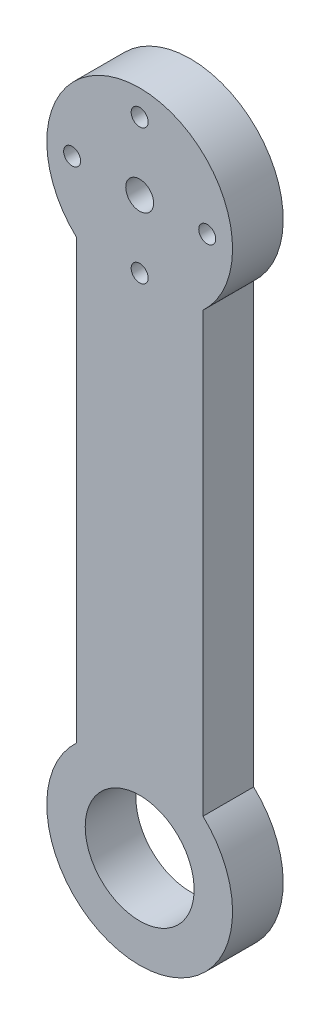
from build123d import *

# Parameters (mm, degrees)
ESQUISSE1_W             = 15
ESQUISSE1_H             = 83
BOSS_EXTRU_1_DEPTH      = 6
ESQUISSE2_R             = 11
BOSS_EXTRU_2_DEPTH      = 6
ESQUISSE4_R             = 1.65
ESQUISSE4_R_2           = 1.005
ESQUISSE4_R_3           = 6.45
ENL_V_MAT_EXTRU_2_DEPTH = 10
ESQUISSE5_R             = 3
ESQUISSE5_R_2           = 2
ENL_V_MAT_EXTRU_3_DEPTH = 3


with BuildPart() as part:
    # Esquisse1 → Boss.-Extru.1 (new body)
    with BuildSketch(Plane.XY):
        with Locations((7.5, 41.5)):
            Rectangle(ESQUISSE1_W, ESQUISSE1_H)
    extrude(amount=BOSS_EXTRU_1_DEPTH)

    # Esquisse2 → Boss.-Extru.2 (add)
    with BuildSketch(Plane.XY.offset(6)):
        with Locations((7.5, 7.5)):
            Circle(ESQUISSE2_R)
        with Locations((7.5, 75.5)):
            Circle(ESQUISSE2_R)
    extrude(amount=-BOSS_EXTRU_2_DEPTH)

    # Esquisse4 → Enlèv. mat.-Extru.2 (cut)
    with BuildSketch(Plane(origin=(0, 0, 0), x_dir=(-1, 0, 0), z_dir=(0, 0, -1))):
        with Locations((-7.5, 75.5)):
            Circle(ESQUISSE4_R)
        with Locations((-7.5, 67.5)):
            Circle(ESQUISSE4_R_2)
        with Locations((-15.5, 75.5)):
            Circle(ESQUISSE4_R_2)
        with Locations((-7.5, 83.5)):
            Circle(ESQUISSE4_R_2)
        with Locations((0.5, 75.5)):
            Circle(ESQUISSE4_R_2)
        with Locations((-7.5, 7.5)):
            Circle(ESQUISSE4_R_3)
    extrude(amount=-ENL_V_MAT_EXTRU_2_DEPTH, mode=Mode.SUBTRACT)

    # Esquisse5 → Enlèv. mat.-Extru.3 (cut)
    with BuildSketch(Plane(origin=(0, 0, 0), x_dir=(-1, 0, 0), z_dir=(0, 0, -1))):
        with Locations((-7.5, 75.5)):
            Circle(ESQUISSE5_R)
        with Locations((-15.5, 75.5)):
            Circle(ESQUISSE5_R_2)
        with Locations((-7.5, 83.5)):
            Circle(ESQUISSE5_R_2)
        with Locations((0.5, 75.5)):
            Circle(ESQUISSE5_R_2)
        with Locations((-7.5, 67.5)):
            Circle(ESQUISSE5_R_2)
    extrude(amount=-ENL_V_MAT_EXTRU_3_DEPTH, mode=Mode.SUBTRACT)


solid = part.part
